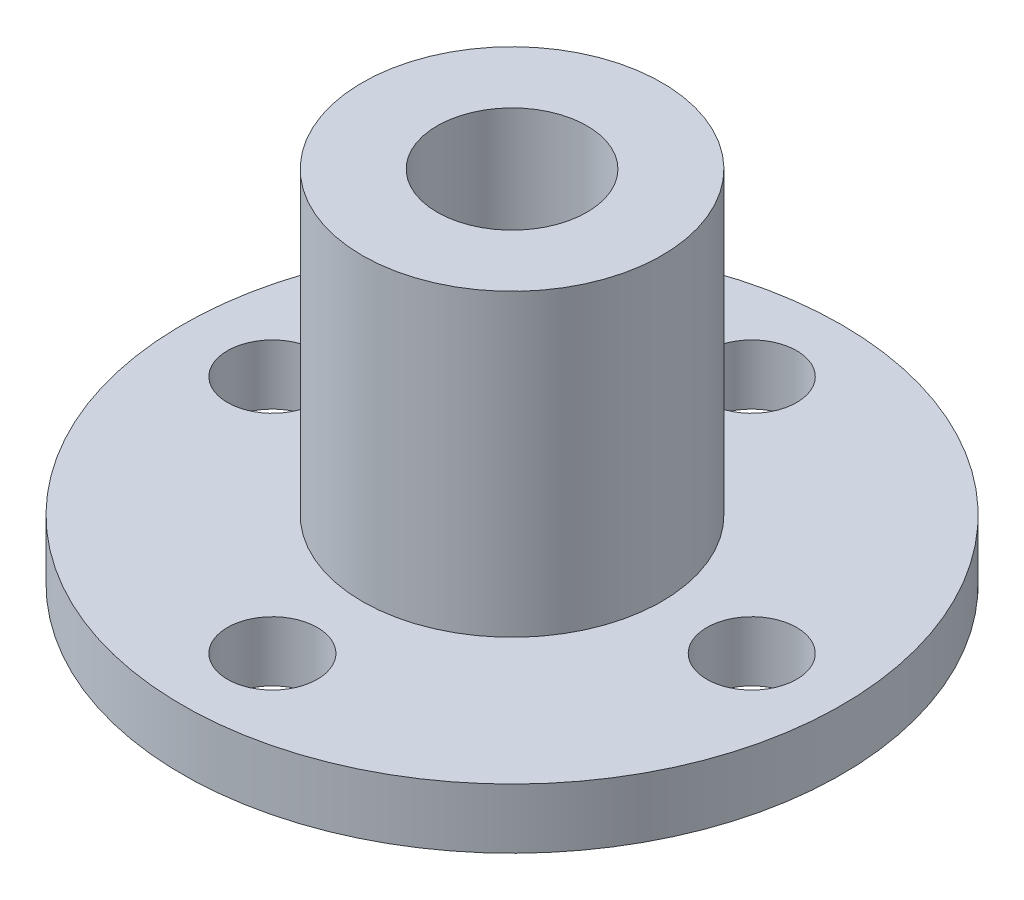
from build123d import *

# Parameters (mm, degrees)
SKETCH_1_R      = 5
SKETCH_1_R_2    = 2.5
EXTRUDE_1_DEPTH = 10
SKETCH_2_R      = 11
SKETCH_2_R_2    = 1.5
EXTRUDE_2_DEPTH = 2


with BuildPart() as part:
    # 草图1 → 凸台-拉伸1 (new body)
    with BuildSketch(Plane(origin=(0, 0, 0), x_dir=(1, 0, 0), z_dir=(0, 1, 0))):
        with Locations(Location((0, 0, 0), (0, 0, 270))):
            Circle(SKETCH_1_R)
        with Locations(Location((0, 0, 0), (0, 0, 270))):
            Circle(SKETCH_1_R_2, mode=Mode.SUBTRACT)
    extrude(amount=EXTRUDE_1_DEPTH)

    # 草图2 → 凸台-拉伸2 (add)
    with BuildSketch(Plane.XZ):
        with Locations(Location((0, 0, 0), (0, 0, 270))):
            Circle(SKETCH_2_R)
        with Locations(Location((0, 8, 0), (0, 0, 270))):
            Circle(SKETCH_2_R_2, mode=Mode.SUBTRACT)
        with Locations(Location((8, 0, 0), (0, 0, 270))):
            Circle(SKETCH_2_R_2, mode=Mode.SUBTRACT)
        with Locations(Location((-8, 0, 0), (0, 0, 90))):
            Circle(SKETCH_2_R_2, mode=Mode.SUBTRACT)
        with Locations(Location((0, -8, 0), (0, 0, 90))):
            Circle(SKETCH_2_R_2, mode=Mode.SUBTRACT)
        with Locations(Location((0, 0, 0), (0, 0, 270))):
            Circle(SKETCH_2_R_2, mode=Mode.SUBTRACT)
    extrude(amount=EXTRUDE_2_DEPTH)


solid = part.part
